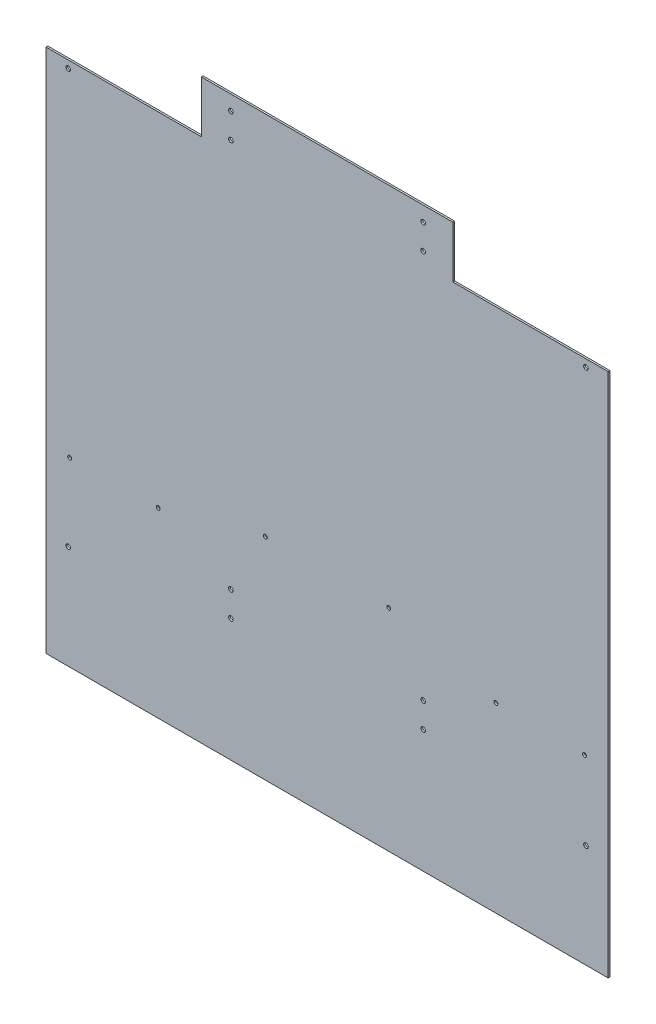
from build123d import *

# Parameters (mm, degrees)
BOSS_EXTRUDE1_DEPTH            = 3.175
F_1_4_CLEARANCE_HOLE1_D        = 6.7564
F_5_16_0_3125_DIAMETER_HOLE1_D = 7.9375


with BuildPart() as part:
    # Sketch2 → Boss-Extrude1 (new body)
    with BuildSketch(Plane.XY):
        Polygon((-482.6, 901.7), (-215.9, 901.7), (-215.9, 990.6), (215.9, 990.6), (215.9, 901.7), (482.6, 901.7), (482.6, 0), (-482.6, 0), align=None)
    extrude(amount=BOSS_EXTRUDE1_DEPTH)

    # 1/4 Clearance Hole1 (through all)
    with Locations(Plane.XY.offset(3.175)):
        with Locations((-441.96, 311.50918615), (105.907561142, 362.110143283), (289.91643105, 312.805115191), (-289.91643105, 312.805115191), (-105.907561142, 362.110143283), (441.96, 311.50918615)):
            Hole(F_1_4_CLEARANCE_HOLE1_D / 2)

    # 5/16 (0.3125) Diameter Hole1 (through all)
    with Locations(Plane.XY.offset(3.175)):
        with Locations((-165.1, 922.02), (-165.1, 965.2), (165.1, 965.2), (165.1, 922.02), (-165.1, 210.82), (-165.1, 254), (165.1, 254), (165.1, 210.82), (-444.5, 177.8), (444.5, 177.8), (-444.5, 889), (444.5, 889)):
            Hole(F_5_16_0_3125_DIAMETER_HOLE1_D / 2)


solid = part.part
